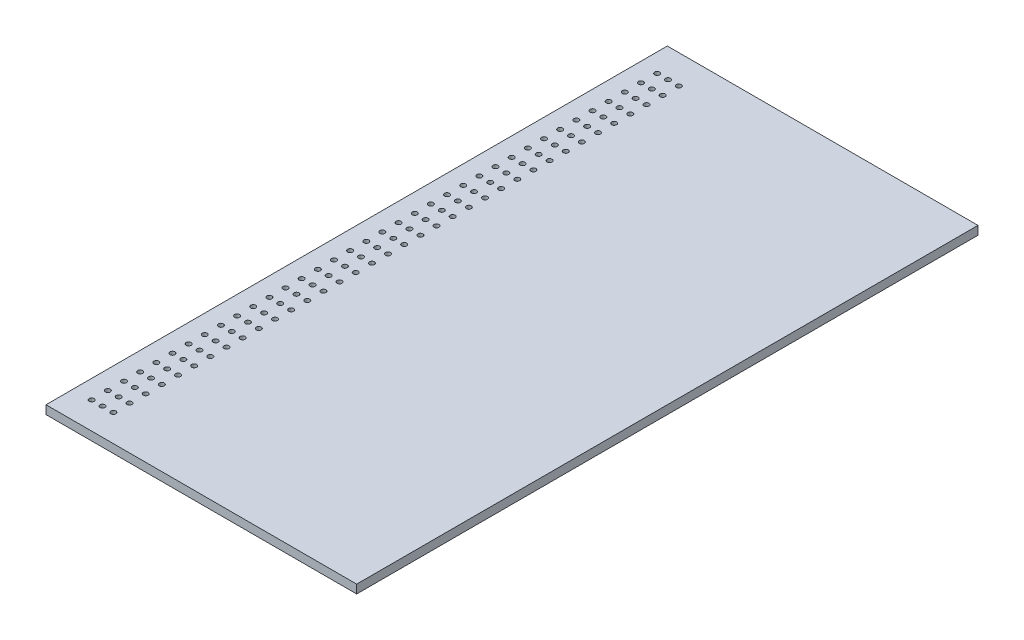
from build123d import *

# Parameters (mm, degrees)
SKETCH1_W           = 50
SKETCH1_H           = 100
BOSS_EXTRUDE1_DEPTH = 1.38
SKETCH2_R           = 0.4
CUT_EXTRUDE1_DEPTH  = 1.38


with BuildPart() as part:
    # Sketch1 → Boss-Extrude1 (new body)
    with BuildSketch(Plane(origin=(0, 0, 0), x_dir=(1, 0, 0), z_dir=(0, 1, 0))):
        with Locations((25, -50)):
            Rectangle(SKETCH1_W, SKETCH1_H)
    extrude(amount=BOSS_EXTRUDE1_DEPTH)

    # Sketch2 → Cut-Extrude1 (cut)
    with BuildSketch(Plane(origin=(0, 1.38, 0), x_dir=(1, 0, 0), z_dir=(0, 1, 0))):
        with Locations(Location((3, -4.65, 0), (0, 0, 270))):
            Circle(SKETCH2_R)
        with Locations(Location((4.75, -4.65, 0), (0, 0, 270))):
            Circle(SKETCH2_R)
        with Locations(Location((6.5, -4.65, 0), (0, 0, 270))):
            Circle(SKETCH2_R)
        with Locations(Location((3, -7.25, 0), (0, 0, 270))):
            Circle(SKETCH2_R)
        with Locations(Location((4.75, -7.25, 0), (0, 0, 270))):
            Circle(SKETCH2_R)
        with Locations(Location((6.5, -7.25, 0), (0, 0, 270))):
            Circle(SKETCH2_R)
        with Locations(Location((3, -9.85, 0), (0, 0, 270))):
            Circle(SKETCH2_R)
        with Locations(Location((4.75, -9.85, 0), (0, 0, 270))):
            Circle(SKETCH2_R)
        with Locations(Location((6.5, -9.85, 0), (0, 0, 270))):
            Circle(SKETCH2_R)
        with Locations(Location((3, -12.45, 0), (0, 0, 270))):
            Circle(SKETCH2_R)
        with Locations(Location((4.75, -12.45, 0), (0, 0, 270))):
            Circle(SKETCH2_R)
        with Locations(Location((6.5, -12.45, 0), (0, 0, 270))):
            Circle(SKETCH2_R)
        with Locations(Location((3, -15.05, 0), (0, 0, 270))):
            Circle(SKETCH2_R)
        with Locations(Location((4.75, -15.05, 0), (0, 0, 270))):
            Circle(SKETCH2_R)
        with Locations(Location((6.5, -15.05, 0), (0, 0, 270))):
            Circle(SKETCH2_R)
        with Locations(Location((3, -17.65, 0), (0, 0, 270))):
            Circle(SKETCH2_R)
        with Locations(Location((4.75, -17.65, 0), (0, 0, 270))):
            Circle(SKETCH2_R)
        with Locations(Location((6.5, -17.65, 0), (0, 0, 270))):
            Circle(SKETCH2_R)
        with Locations(Location((3, -20.25, 0), (0, 0, 270))):
            Circle(SKETCH2_R)
        with Locations(Location((4.75, -20.25, 0), (0, 0, 270))):
            Circle(SKETCH2_R)
        with Locations(Location((6.5, -20.25, 0), (0, 0, 270))):
            Circle(SKETCH2_R)
        with Locations(Location((3, -22.85, 0), (0, 0, 270))):
            Circle(SKETCH2_R)
        with Locations(Location((4.75, -22.85, 0), (0, 0, 270))):
            Circle(SKETCH2_R)
        with Locations(Location((6.5, -22.85, 0), (0, 0, 270))):
            Circle(SKETCH2_R)
        with Locations(Location((3, -25.45, 0), (0, 0, 270))):
            Circle(SKETCH2_R)
        with Locations(Location((4.75, -25.45, 0), (0, 0, 270))):
            Circle(SKETCH2_R)
        with Locations(Location((6.5, -25.45, 0), (0, 0, 270))):
            Circle(SKETCH2_R)
        with Locations(Location((3, -28.05, 0), (0, 0, 270))):
            Circle(SKETCH2_R)
        with Locations(Location((4.75, -28.05, 0), (0, 0, 270))):
            Circle(SKETCH2_R)
        with Locations(Location((6.5, -28.05, 0), (0, 0, 270))):
            Circle(SKETCH2_R)
        with Locations(Location((3, -30.65, 0), (0, 0, 270))):
            Circle(SKETCH2_R)
        with Locations(Location((4.75, -30.65, 0), (0, 0, 270))):
            Circle(SKETCH2_R)
        with Locations(Location((6.5, -30.65, 0), (0, 0, 270))):
            Circle(SKETCH2_R)
        with Locations(Location((3, -33.25, 0), (0, 0, 270))):
            Circle(SKETCH2_R)
        with Locations(Location((4.75, -33.25, 0), (0, 0, 270))):
            Circle(SKETCH2_R)
        with Locations(Location((6.5, -33.25, 0), (0, 0, 270))):
            Circle(SKETCH2_R)
        with Locations(Location((3, -35.85, 0), (0, 0, 270))):
            Circle(SKETCH2_R)
        with Locations(Location((4.75, -35.85, 0), (0, 0, 270))):
            Circle(SKETCH2_R)
        with Locations(Location((6.5, -35.85, 0), (0, 0, 270))):
            Circle(SKETCH2_R)
        with Locations(Location((3, -38.45, 0), (0, 0, 270))):
            Circle(SKETCH2_R)
        with Locations(Location((4.75, -38.45, 0), (0, 0, 270))):
            Circle(SKETCH2_R)
        with Locations(Location((6.5, -38.45, 0), (0, 0, 270))):
            Circle(SKETCH2_R)
        with Locations(Location((3, -41.05, 0), (0, 0, 270))):
            Circle(SKETCH2_R)
        with Locations(Location((4.75, -41.05, 0), (0, 0, 270))):
            Circle(SKETCH2_R)
        with Locations(Location((6.5, -41.05, 0), (0, 0, 270))):
            Circle(SKETCH2_R)
        with Locations(Location((3, -43.65, 0), (0, 0, 270))):
            Circle(SKETCH2_R)
        with Locations(Location((4.75, -43.65, 0), (0, 0, 270))):
            Circle(SKETCH2_R)
        with Locations(Location((6.5, -43.65, 0), (0, 0, 270))):
            Circle(SKETCH2_R)
        with Locations(Location((3, -46.25, 0), (0, 0, 270))):
            Circle(SKETCH2_R)
        with Locations(Location((4.75, -46.25, 0), (0, 0, 270))):
            Circle(SKETCH2_R)
        with Locations(Location((6.5, -46.25, 0), (0, 0, 270))):
            Circle(SKETCH2_R)
        with Locations(Location((3, -48.85, 0), (0, 0, 270))):
            Circle(SKETCH2_R)
        with Locations(Location((4.75, -48.85, 0), (0, 0, 270))):
            Circle(SKETCH2_R)
        with Locations(Location((6.5, -48.85, 0), (0, 0, 270))):
            Circle(SKETCH2_R)
        with Locations(Location((3, -51.45, 0), (0, 0, 270))):
            Circle(SKETCH2_R)
        with Locations(Location((4.75, -51.45, 0), (0, 0, 270))):
            Circle(SKETCH2_R)
        with Locations(Location((6.5, -51.45, 0), (0, 0, 270))):
            Circle(SKETCH2_R)
        with Locations(Location((3, -54.05, 0), (0, 0, 270))):
            Circle(SKETCH2_R)
        with Locations(Location((4.75, -54.05, 0), (0, 0, 270))):
            Circle(SKETCH2_R)
        with Locations(Location((6.5, -54.05, 0), (0, 0, 270))):
            Circle(SKETCH2_R)
        with Locations(Location((3, -56.65, 0), (0, 0, 270))):
            Circle(SKETCH2_R)
        with Locations(Location((4.75, -56.65, 0), (0, 0, 270))):
            Circle(SKETCH2_R)
        with Locations(Location((6.5, -56.65, 0), (0, 0, 270))):
            Circle(SKETCH2_R)
        with Locations(Location((3, -59.25, 0), (0, 0, 270))):
            Circle(SKETCH2_R)
        with Locations(Location((4.75, -59.25, 0), (0, 0, 270))):
            Circle(SKETCH2_R)
        with Locations(Location((6.5, -59.25, 0), (0, 0, 270))):
            Circle(SKETCH2_R)
        with Locations(Location((3, -61.85, 0), (0, 0, 270))):
            Circle(SKETCH2_R)
        with Locations(Location((4.75, -61.85, 0), (0, 0, 270))):
            Circle(SKETCH2_R)
        with Locations(Location((6.5, -61.85, 0), (0, 0, 270))):
            Circle(SKETCH2_R)
        with Locations(Location((3, -64.45, 0), (0, 0, 270))):
            Circle(SKETCH2_R)
        with Locations(Location((4.75, -64.45, 0), (0, 0, 270))):
            Circle(SKETCH2_R)
        with Locations(Location((6.5, -64.45, 0), (0, 0, 270))):
            Circle(SKETCH2_R)
        with Locations(Location((3, -67.05, 0), (0, 0, 270))):
            Circle(SKETCH2_R)
        with Locations(Location((4.75, -67.05, 0), (0, 0, 270))):
            Circle(SKETCH2_R)
        with Locations(Location((6.5, -67.05, 0), (0, 0, 270))):
            Circle(SKETCH2_R)
        with Locations(Location((3, -69.65, 0), (0, 0, 270))):
            Circle(SKETCH2_R)
        with Locations(Location((4.75, -69.65, 0), (0, 0, 270))):
            Circle(SKETCH2_R)
        with Locations(Location((6.5, -69.65, 0), (0, 0, 270))):
            Circle(SKETCH2_R)
        with Locations(Location((3, -72.25, 0), (0, 0, 270))):
            Circle(SKETCH2_R)
        with Locations(Location((4.75, -72.25, 0), (0, 0, 270))):
            Circle(SKETCH2_R)
        with Locations(Location((6.5, -72.25, 0), (0, 0, 270))):
            Circle(SKETCH2_R)
        with Locations(Location((3, -74.85, 0), (0, 0, 270))):
            Circle(SKETCH2_R)
        with Locations(Location((4.75, -74.85, 0), (0, 0, 270))):
            Circle(SKETCH2_R)
        with Locations(Location((6.5, -74.85, 0), (0, 0, 270))):
            Circle(SKETCH2_R)
        with Locations(Location((3, -77.45, 0), (0, 0, 270))):
            Circle(SKETCH2_R)
        with Locations(Location((4.75, -77.45, 0), (0, 0, 270))):
            Circle(SKETCH2_R)
        with Locations(Location((6.5, -77.45, 0), (0, 0, 270))):
            Circle(SKETCH2_R)
        with Locations(Location((3, -80.05, 0), (0, 0, 270))):
            Circle(SKETCH2_R)
        with Locations(Location((4.75, -80.05, 0), (0, 0, 270))):
            Circle(SKETCH2_R)
        with Locations(Location((6.5, -80.05, 0), (0, 0, 270))):
            Circle(SKETCH2_R)
        with Locations(Location((3, -82.65, 0), (0, 0, 270))):
            Circle(SKETCH2_R)
        with Locations(Location((4.75, -82.65, 0), (0, 0, 270))):
            Circle(SKETCH2_R)
        with Locations(Location((6.5, -82.65, 0), (0, 0, 270))):
            Circle(SKETCH2_R)
        with Locations(Location((3, -85.25, 0), (0, 0, 270))):
            Circle(SKETCH2_R)
        with Locations(Location((4.75, -85.25, 0), (0, 0, 270))):
            Circle(SKETCH2_R)
        with Locations(Location((6.5, -85.25, 0), (0, 0, 270))):
            Circle(SKETCH2_R)
        with Locations(Location((3, -87.85, 0), (0, 0, 270))):
            Circle(SKETCH2_R)
        with Locations(Location((4.75, -87.85, 0), (0, 0, 270))):
            Circle(SKETCH2_R)
        with Locations(Location((6.5, -87.85, 0), (0, 0, 270))):
            Circle(SKETCH2_R)
        with Locations(Location((3, -90.45, 0), (0, 0, 270))):
            Circle(SKETCH2_R)
        with Locations(Location((4.75, -90.45, 0), (0, 0, 270))):
            Circle(SKETCH2_R)
        with Locations(Location((6.5, -90.45, 0), (0, 0, 270))):
            Circle(SKETCH2_R)
        with Locations(Location((3, -93.05, 0), (0, 0, 270))):
            Circle(SKETCH2_R)
        with Locations(Location((4.75, -93.05, 0), (0, 0, 270))):
            Circle(SKETCH2_R)
        with Locations(Location((6.5, -93.05, 0), (0, 0, 270))):
            Circle(SKETCH2_R)
        with Locations(Location((3, -95.65, 0), (0, 0, 270))):
            Circle(SKETCH2_R)
        with Locations(Location((4.75, -95.65, 0), (0, 0, 270))):
            Circle(SKETCH2_R)
        with Locations(Location((6.5, -95.65, 0), (0, 0, 270))):
            Circle(SKETCH2_R)
    extrude(amount=-CUT_EXTRUDE1_DEPTH, mode=Mode.SUBTRACT)


solid = part.part
